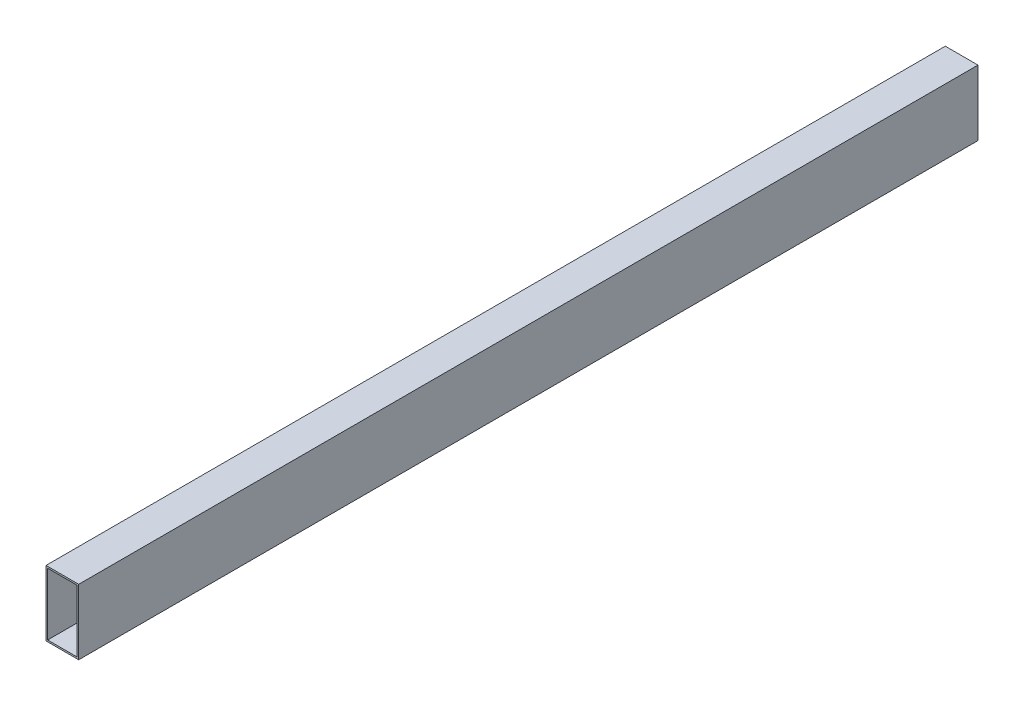
from build123d import *

# Parameters (mm, degrees)
SKETCH_1_W      = 20
SKETCH_1_H      = 40
SKETCH_1_W_2    = 18
SKETCH_1_H_2    = 38
EXTRUDE_1_DEPTH = 550


with BuildPart() as part:
    # 草图1 → 拉伸-薄壁1 (new body)
    with BuildSketch(Plane.XY):
        with Locations((10, -20)):
            Rectangle(SKETCH_1_W, SKETCH_1_H)
        with Locations((10, -20)):
            Rectangle(SKETCH_1_W_2, SKETCH_1_H_2, mode=Mode.SUBTRACT)
    extrude(amount=EXTRUDE_1_DEPTH)


solid = part.part
